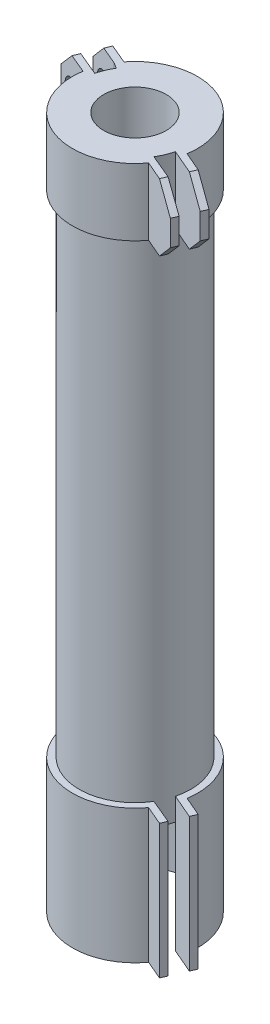
from build123d import *

# Parameters (mm, degrees)
BOSS_EXTRUDE1_DEPTH      = 150
BOSS_EXTRUDE1_DEPTH_BACK = 110
SKETCH1_R                = 25
SKETCH1_R_2              = 14
BOSS_EXTRUDE2_DEPTH      = 30
SKETCH4_R                = 6
CUT_EXTRUDE1_DEPTH       = 30
CUT_EXTRUDE3_DEPTH       = 30
CUT_EXTRUDE4_DEPTH       = 30
BOSS_EXTRUDE3_DEPTH      = 50
BOSS_EXTRUDE3_DEPTH_BACK = 10
SKETCH10_R               = 6
CUT_EXTRUDE5_DEPTH       = 20


with BuildPart() as part:
    # Sketch1 → Boss-Extrude1 (new, two sides: drawn at the far end of the back side and taken through both)
    with BuildSketch(Plane(origin=(0, 0, 0), x_dir=(1, 0, 0), z_dir=(0, 1, 0)).offset(-BOSS_EXTRUDE1_DEPTH_BACK)):
        with Locations(Location((0, 0, 0), (0, 0, 270))):
            Circle(SKETCH1_R)
        with Locations(Location((0, 0, 0), (0, 0, 270))):
            Circle(SKETCH1_R_2, mode=Mode.SUBTRACT)
    extrude(amount=BOSS_EXTRUDE1_DEPTH + BOSS_EXTRUDE1_DEPTH_BACK)

    # Sketch2 → Boss-Extrude2 (add)
    with BuildSketch(Plane(origin=(0, 150, 0), x_dir=(1, 0, 0), z_dir=(0, 1, 0))):
        with BuildLine():
            Line((-23.915836384, 14.561345064), (-21.353425342, 13.00120095))
            ThreePointArc((-21.353425342, 13.00120095), (9.671523715, 23.053451564), (24.237934753, -6.125562743))
            Line((24.237934753, -6.125562743), (43.683817295, -14.479533157))
            Line((43.683817295, -14.479533157), (44.867972274, -11.723126622))
            Line((44.867972274, -11.723126622), (27.66288952, -4.331806018))
            ThreePointArc((27.66288952, -4.331806018), (11.097692173, 25.70683233), (-22.124313852, 17.161431659))
            Line((-22.124313852, 17.161431659), (-39.224178944, 24.402944888))
            Line((-39.224178944, 24.402944888), (-40.408333923, 21.646538353))
            Line((-40.408333923, 21.646538353), (-23.915836384, 14.561345064))
        make_face()
        with BuildLine():
            Line((-43.500856668, 14.266360747), (-24.222080563, 6.187957111))
            ThreePointArc((-24.222080563, 6.187957111), (-9.661815141, -23.057522161), (21.397729285, -12.928154604))
            Line((21.397729285, -12.928154604), (40.848787327, -21.078749702))
            Line((40.848787327, -21.078749702), (39.664632347, -23.835156237))
            Line((39.664632347, -23.835156237), (22.614348516, -16.510337404))
            ThreePointArc((22.614348516, -16.510337404), (-10.742271175, -25.857370516), (-27.656212868, 4.374230197))
            Line((-27.656212868, 4.374230197), (-44.660274485, 11.499458088))
            Line((-44.660274485, 11.499458088), (-43.500856668, 14.266360747))
        make_face()
    extrude(amount=-BOSS_EXTRUDE2_DEPTH)

    # Sketch4 → Cut-Extrude1 (cut)
    with BuildSketch(Plane(origin=(2.798049006, 0, -6.607218549), x_dir=(-0.9208327997677669, 0, -0.38995763214977075), z_dir=(0.3899576321497707, 0, -0.9208327997677668))):
        with Locations(Location((36.350025121, 135, 0), (0, 0, 180))):
            Circle(SKETCH4_R)
    extrude(amount=-CUT_EXTRUDE1_DEPTH, mode=Mode.SUBTRACT)

    # Sketch6 → Cut-Extrude3 (cut)
    with BuildSketch(Plane(origin=(-2.464398676, 0, 5.736482753), x_dir=(0.9188021782605189, 0, 0.39471832643509935), z_dir=(-0.39471832643509935, 0, 0.9188021782605189))):
        Polygon((36.573584503, 150), (45.852123581, 140.721460922), (66.07138883, 154.845920949), align=None)
        Polygon((36.573584503, 120), (62.874627202, 146.301042699), (73.132170225, 136.043499677), (73.132170225, 101.712575759), align=None)
    extrude(amount=-CUT_EXTRUDE3_DEPTH, mode=Mode.SUBTRACT)

    # Sketch7 → Cut-Extrude4 (cut)
    with BuildSketch(Plane(origin=(-2.571593456, 0, 6.137001406), x_dir=(0.9223008864267629, 0, 0.3864726056221933), z_dir=(-0.3864726056221933, 0, 0.9223008864267629))):
        Polygon((-36.416153031, 150), (-45.634436276, 140.781716754), (-52.238797728, 153.982696948), (-36.416153031, 153.982696948), align=None)
        Polygon((-36.416153031, 120), (-66.089359291, 149.67320626), (-66.089359291, 112.136229403), align=None)
    extrude(amount=-CUT_EXTRUDE4_DEPTH, mode=Mode.SUBTRACT)

    # Sketch8 → Boss-Extrude3 (add, two sides: drawn at the far end of the back side and taken through both)
    with BuildSketch(Plane.XZ.offset(110).offset(-BOSS_EXTRUDE3_DEPTH_BACK)):
        with BuildLine():
            Line((-23.915836384, -14.561345064), (-31.938215406, -18.007767043))
            Line((-31.938215406, -18.007767043), (-40.408333923, -21.646538353))
            Line((-40.408333923, -21.646538353), (-39.224178944, -24.402944888))
            Line((-39.224178944, -24.402944888), (-30.760365079, -20.818658126))
            Line((-30.760365079, -20.818658126), (-22.124313852, -17.161431659))
            ThreePointArc((-22.124313852, -17.161431659), (11.097692173, -25.70683233), (27.66288952, 4.331806018))
            Line((27.66288952, 4.331806018), (36.342830359, 8.060717205))
            Line((36.342830359, 8.060717205), (35.15867538, 10.81712374))
            Line((35.15867538, 10.81712374), (24.237934753, 6.125562743))
            ThreePointArc((24.237934753, 6.125562743), (9.671523715, -23.053451564), (-21.353425342, -13.00120095))
            Line((-21.353425342, -13.00120095), (-23.915836384, -14.561345064))
        make_face()
        with BuildLine():
            Line((-27.656212868, -4.374230197), (-36.158243676, -7.936844143))
            Line((-36.158243676, -7.936844143), (-44.660274485, -11.499458088))
            Line((-44.660274485, -11.499458088), (-43.500856668, -14.266360747))
            Line((-43.500856668, -14.266360747), (-34.998825859, -10.703746802))
            Line((-34.998825859, -10.703746802), (-24.222080563, -6.187957111))
            ThreePointArc((-24.222080563, -6.187957111), (-9.661815141, 23.057522161), (21.397729285, 12.928154604))
            Line((21.397729285, 12.928154604), (32.290839196, 17.492704669))
            Line((32.290839196, 17.492704669), (31.139490432, 20.17274682))
            Line((31.139490432, 20.17274682), (22.614348516, 16.510337404))
            ThreePointArc((22.614348516, 16.510337404), (-10.742271175, 25.857370516), (-27.656212868, -4.374230197))
        make_face()
    extrude(amount=BOSS_EXTRUDE3_DEPTH + BOSS_EXTRUDE3_DEPTH_BACK)

    # Sketch10 → Cut-Extrude5 (cut)
    with BuildSketch(Plane(origin=(2.798049006, 0, -6.607218549), x_dir=(-0.9208327997677666, 0, -0.3899576321497714), z_dir=(0.3899576321497714, 0, -0.9208327997677666))):
        with Locations(Location((35.51571532, -149.915667196, 0), (0, 0, 180))):
            Circle(SKETCH10_R)
    extrude(amount=-CUT_EXTRUDE5_DEPTH, mode=Mode.SUBTRACT)


solid = part.part
